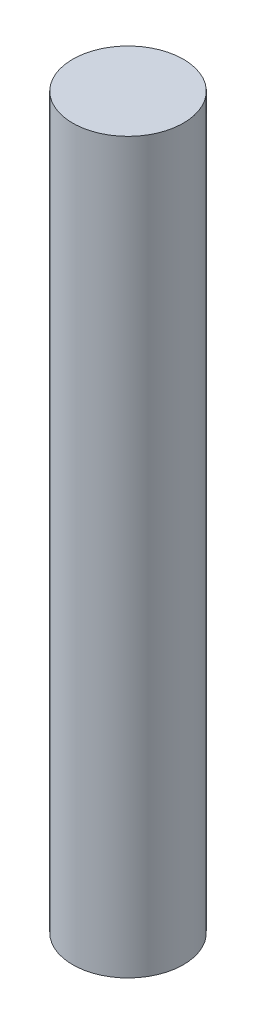
from build123d import *

# Parameters (mm, degrees)
SKETCH1_R           = 3.95
BOSS_EXTRUDE1_DEPTH = 52


with BuildPart() as part:
    # Sketch1 → Boss-Extrude1 (new body)
    with BuildSketch(Plane(origin=(0, 0, 0), x_dir=(1, 0, 0), z_dir=(0, 1, 0))):
        with Locations(Location((0, 0, 0), (0, 0, 90))):
            Circle(SKETCH1_R)
    extrude(amount=BOSS_EXTRUDE1_DEPTH)


solid = part.part
